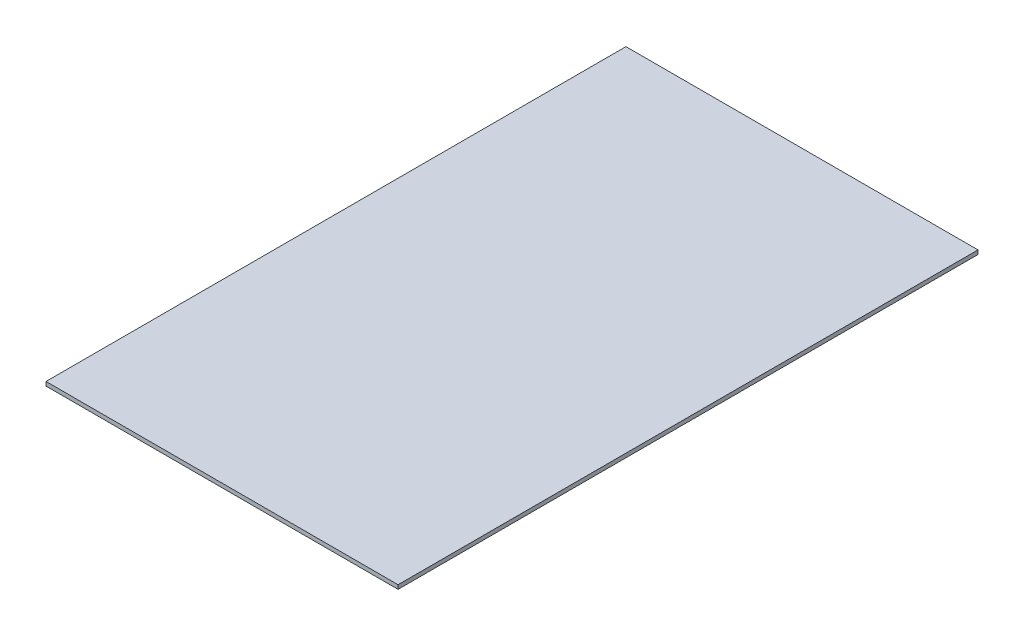
from build123d import *

# Parameters (mm, degrees)
SKETCH1_W           = 277.55342
SKETCH1_H           = 3.175
BOSS_EXTRUDE1_DEPTH = 457.2


with BuildPart() as part:
    # Sketch1 → Boss-Extrude1 (new body)
    with BuildSketch(Plane.XY):
        Rectangle(SKETCH1_W, SKETCH1_H)
    extrude(amount=BOSS_EXTRUDE1_DEPTH)


solid = part.part
